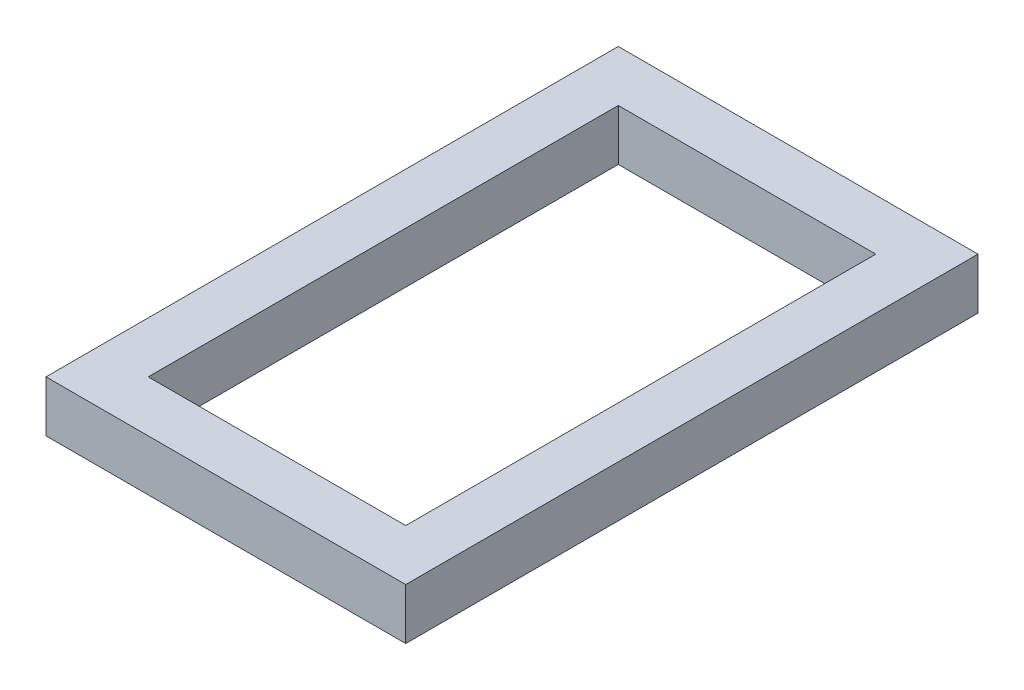
from build123d import *

# Parameters (mm, degrees)
SKETCH1_W           = 17.6
SKETCH1_H           = 28
SKETCH1_W_2         = 12.6
SKETCH1_H_2         = 23
BOSS_EXTRUDE1_DEPTH = 2.5


with BuildPart() as part:
    # Sketch1 → Boss-Extrude1 (new body)
    with BuildSketch(Plane(origin=(0, 0, 0), x_dir=(1, 0, 0), z_dir=(0, 1, 0))):
        Rectangle(SKETCH1_W, SKETCH1_H)
        Rectangle(SKETCH1_W_2, SKETCH1_H_2, mode=Mode.SUBTRACT)
    extrude(amount=BOSS_EXTRUDE1_DEPTH)


solid = part.part
